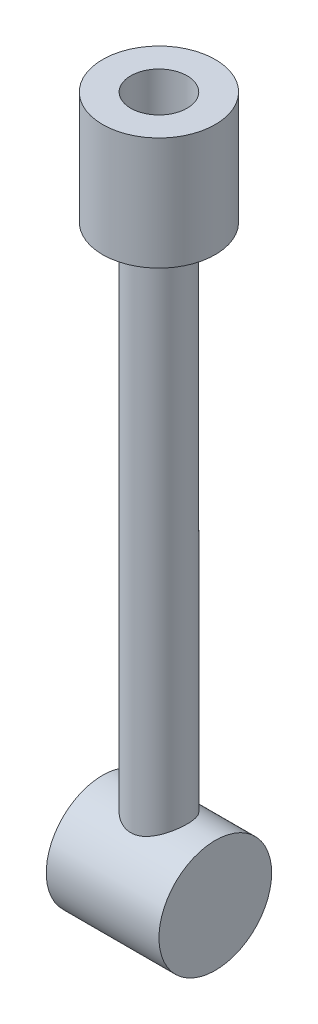
from build123d import *

# Parameters (mm, degrees)
CROQUIS1_R              = 50
SALIENTE_EXTRUIR1_DEPTH = 50
CROQUIS2_R              = 25
SALIENTE_EXTRUIR2_DEPTH = 500
CROQUIS3_R              = 50
SALIENTE_EXTRUIR3_DEPTH = 100
CORTAR_EXTRUIR1_START   = -50
CROQUIS4_R              = 25
CORTAR_EXTRUIR1_DEPTH   = 50


with BuildPart() as part:
    # Croquis1 → Saliente-Extruir1 (new, symmetric)
    with BuildSketch(Plane(origin=(0, 0, 0), x_dir=(0, 0, -1), z_dir=(1, 0, 0))):
        Circle(CROQUIS1_R)
    extrude(amount=SALIENTE_EXTRUIR1_DEPTH, both=True)

    # Croquis2 → Saliente-Extruir2 (add)
    with BuildSketch(Plane(origin=(0, 0, 0), x_dir=(1, 0, 0), z_dir=(0, 1, 0))):
        with Locations(Location((0, 0, 0), (0, 0, 90))):
            Circle(CROQUIS2_R)
    extrude(amount=SALIENTE_EXTRUIR2_DEPTH)

    # Croquis3 → Saliente-Extruir3 (add)
    with BuildSketch(Plane(origin=(0, 500, 0), x_dir=(1, 0, 0), z_dir=(0, 1, 0))):
        with Locations(Location((0, 0, 0), (0, 0, 270))):
            Circle(CROQUIS3_R)
    extrude(amount=SALIENTE_EXTRUIR3_DEPTH)

    # Croquis4 → Cortar-Extruir1 (cut)
    with BuildSketch(Plane(origin=(0, 600, 0), x_dir=(1, 0, 0), z_dir=(0, 1, 0)).offset(CORTAR_EXTRUIR1_START)):
        with Locations(Location((0, 0, 0), (0, 0, 90))):
            Circle(CROQUIS4_R)
    extrude(amount=CORTAR_EXTRUIR1_DEPTH, mode=Mode.SUBTRACT)


solid = part.part
